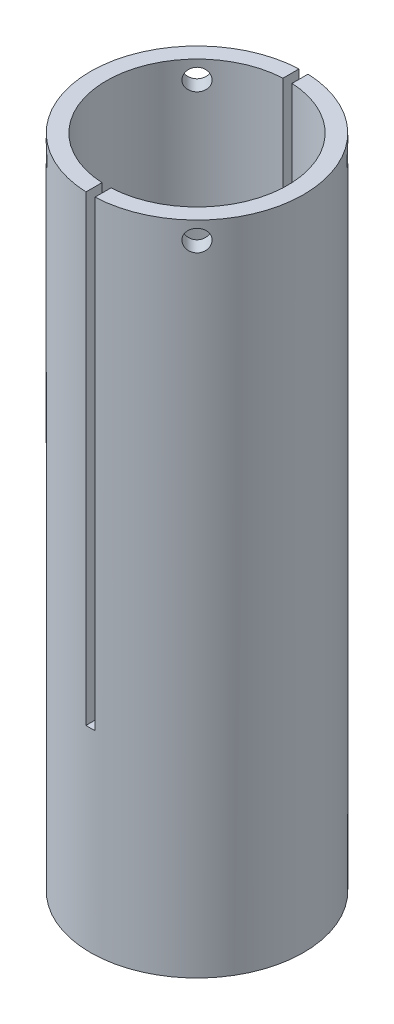
from build123d import *

# Parameters (mm, degrees)
SKETCH1_R                            = 3
SKETCH1_R_2                          = 2.55
BOSS_EXTRUDE1_DEPTH                  = 18.47
CUT_EXTRUDE1_DEPTH                   = 19.951013166
CUT_EXTRUDE1_DEPTH_BACK              = 19.951013166
SKETCH2_W                            = 0.254
SKETCH2_H                            = 13
F_0_6_0_6_DIAMETER_HOLE1_D           = 0.6
F_0_6_0_6_DIAMETER_HOLE1_ON_FACE_2_D = 0.6
F_0_6_0_6_DIAMETER_HOLE1_ON_FACE_3_D = 0.6
F_0_6_0_6_DIAMETER_HOLE1_ON_FACE_4_D = 0.6


with BuildPart() as part:
    # Sketch1 → Boss-Extrude1 (new body)
    with BuildSketch(Plane(origin=(0, 0, 0), x_dir=(1, 0, 0), z_dir=(0, 1, 0))):
        with Locations(Location((0, 0, 0), (0, 0, 270))):
            Circle(SKETCH1_R)
        with Locations(Location((0, 0, 0), (0, 0, 270))):
            Circle(SKETCH1_R_2, mode=Mode.SUBTRACT)
    extrude(amount=BOSS_EXTRUDE1_DEPTH)

    # Sketch2 → Cut-Extrude1 (cut, two sides: drawn at the far end of the back side and taken through both)
    with BuildSketch(Plane.XY.offset(-CUT_EXTRUDE1_DEPTH_BACK)):
        with Locations((0, 11.97)):
            Rectangle(SKETCH2_W, SKETCH2_H)
    extrude(amount=CUT_EXTRUDE1_DEPTH + CUT_EXTRUDE1_DEPTH_BACK, mode=Mode.SUBTRACT)

    # Ø0.6 (0.6) Diameter Hole1 (through all)
    with Locations(Plane(origin=(2.121320344, 17.97, 2.121320344), x_dir=(0.707106781187, 0, -0.707106781187), z_dir=(0.707106781187, 0, 0.707106781187))):
        with Locations((0, 0)):
            Hole(F_0_6_0_6_DIAMETER_HOLE1_D / 2)

    # Ø0.6 (0.6) Diameter Hole1 on face 2 (through all)
    with Locations(Plane(origin=(2.121320344, 17.97, -2.121320344), x_dir=(-0.707106781187, 0, -0.707106781187), z_dir=(0.707106781187, 0, -0.707106781187))):
        with Locations((0, 0)):
            Hole(F_0_6_0_6_DIAMETER_HOLE1_ON_FACE_2_D / 2)

    # Ø0.6 (0.6) Diameter Hole1 on face 3 (through all)
    with Locations(Plane(origin=(-2.121320344, 17.97, 2.121320344), x_dir=(0.707106781187, 0, 0.707106781187), z_dir=(-0.707106781187, 0, 0.707106781187))):
        with Locations((0, 0)):
            Hole(F_0_6_0_6_DIAMETER_HOLE1_ON_FACE_3_D / 2)

    # Ø0.6 (0.6) Diameter Hole1 on face 4 (through all)
    with Locations(Plane(origin=(-2.121320344, 17.97, -2.121320344), x_dir=(-0.707106781187, 0, 0.707106781187), z_dir=(-0.707106781187, 0, -0.707106781187))):
        with Locations((0, 0)):
            Hole(F_0_6_0_6_DIAMETER_HOLE1_ON_FACE_4_D / 2)


solid = part.part
